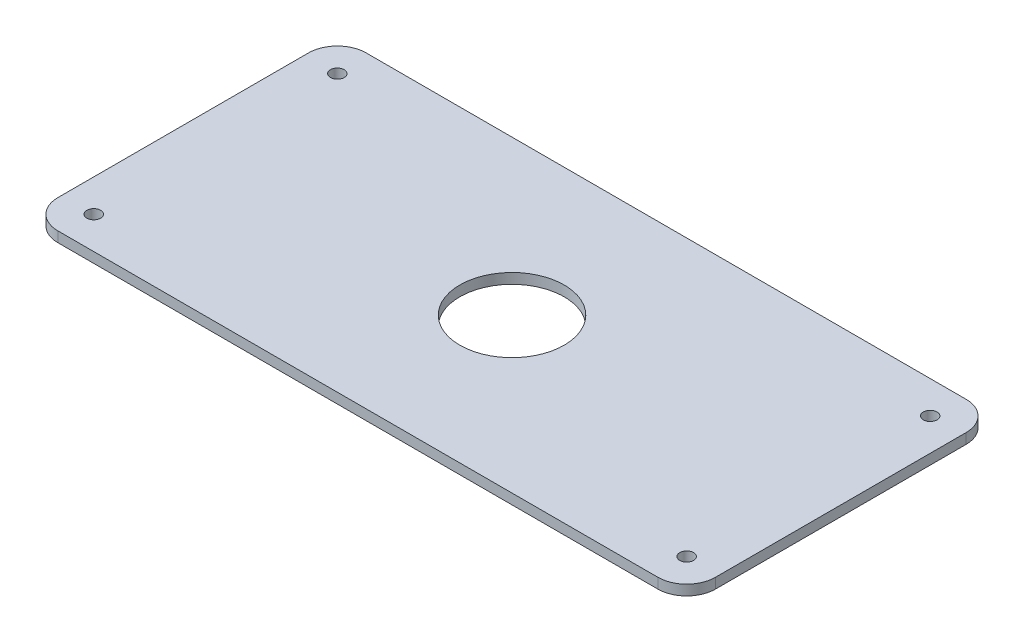
from build123d import *

# Parameters (mm, degrees)
SKETCH1_W           = 406.4
SKETCH1_H           = 190.5
BOSS_EXTRUDE1_DEPTH = 6.35
SKETCH2_R           = 32.25
CUT_EXTRUDE1_DEPTH  = 225.506403027
SKETCH3_R           = 4.25
CUT_EXTRUDE2_DEPTH  = 225.506403027
FILLET1_R           = 17.78


with BuildPart() as part:
    # Sketch1 → Boss-Extrude1 (new body)
    with BuildSketch(Plane(origin=(0, 0, 0), x_dir=(1, 0, 0), z_dir=(0, 1, 0))):
        Rectangle(SKETCH1_W, SKETCH1_H)
    extrude(amount=BOSS_EXTRUDE1_DEPTH)

    # Sketch2 → Cut-Extrude1 (cut, through all)
    with BuildSketch(Plane(origin=(0, 6.35, 0), x_dir=(1, 0, 0), z_dir=(0, 1, 0))):
        with Locations(Location((0, 0, 0), (0, 0, 270))):
            Circle(SKETCH2_R)
    extrude(amount=-CUT_EXTRUDE1_DEPTH, mode=Mode.SUBTRACT)

    # Sketch3 → Cut-Extrude2 (cut, through all)
    with BuildSketch(Plane(origin=(0, 6.35, 0), x_dir=(1, 0, 0), z_dir=(0, 1, 0))):
        with Locations(Location((-183.2, 75.25, 0), (0, 0, 270))):
            Circle(SKETCH3_R)
        with Locations(Location((183.2, 75.25, 0), (0, 0, 270))):
            Circle(SKETCH3_R)
        with Locations(Location((183.2, -75.25, 0), (0, 0, 270))):
            Circle(SKETCH3_R)
        with Locations(Location((-183.2, -75.25, 0), (0, 0, 270))):
            Circle(SKETCH3_R)
    extrude(amount=-CUT_EXTRUDE2_DEPTH, mode=Mode.SUBTRACT)

    # Fillet1
    fillet1_edges = [part.edges().sort_by_distance(p)[0] for p in [
        (203.2, 3.175, 95.25),
        (-203.2, 3.175, 95.25),
        (-203.2, 3.175, -95.25),
        (203.2, 3.175, -95.25),
    ]]
    fillet(fillet1_edges, radius=FILLET1_R)


solid = part.part
